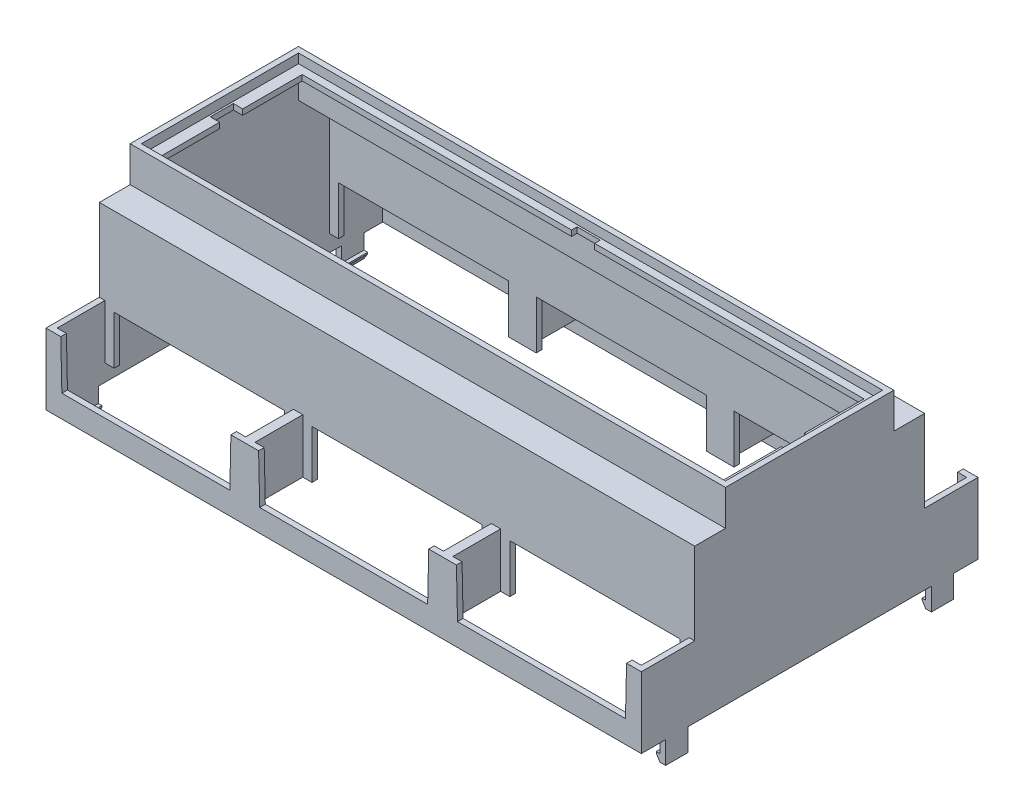
from build123d import *

# Parameters (mm, degrees)
SKETCH_1_W                 = 159.5
SKETCH_1_H                 = 90.2
EXTRUDE_1_DEPTH            = 50.5
CUT_EXTRUDE_1_DEPTH        = 174.275820587
SHELL_1_T                  = -1.5
SKETCH_3_W                 = 6
SKETCH_3_H                 = 6
EXTRUDE_3_DEPTH            = 1.5
EXTRUDE_4_DEPTH            = 6
MIRROR_2_COPY_1_SKETCH_W   = 6
MIRROR_2_COPY_1_SKETCH_H   = 6
MIRROR_2_COPY_1_DEPTH      = 1.5
MIRROR_2_COPY_2_DEPTH      = 6
SKETCH_6_W                 = 50.5
SKETCH_6_H                 = 12.8
CUT_EXTRUDE_2_DEPTH        = 20
CUT_EXTRUDE_3_DEPTH        = 10
PATTERN_LINEAR_1_COUNT     = 2
PATTERN_LINEAR_1_PITCH     = 53
PATTERN_LINEAR_1_COL_COUNT = 2
PATTERN_LINEAR_1_COL_PITCH = 53
SKETCH_8_W                 = 2.45
SKETCH_8_H                 = 1.5
EXTRUDE_5_DEPTH            = 16
SKETCH_9_W                 = 156.5
SKETCH_9_H                 = 22.55
CUT_EXTRUDE_4_DEPTH        = 4.5
MIRROR_3_COPY_1_DEPTH      = 10
MIRROR_3_COPY_2_DEPTH      = 10
SKETCH_10_W                = 159.5
SKETCH_10_H                = 45.1
EXTRUDE_6_DEPTH            = 4
SKETCH_11_W                = 156.5
SKETCH_11_H                = 42.1
CUT_EXTRUDE_6_DEPTH        = 2.5
SKETCH_12_W                = 150.5
SKETCH_12_H                = 38.1
CUT_EXTRUDE_7_DEPTH        = 4
SKETCH_13_W                = 4
SKETCH_13_H                = 6.2
SKETCH_13_W_2              = 6.2
SKETCH_13_H_2              = 4
CUT_EXTRUDE_8_DEPTH        = 4


with BuildPart() as part:
    # Эскиз1 → Бобышка-Вытянуть1 (new body)
    with BuildSketch(Plane(origin=(0, 0, 0), x_dir=(1, 0, 0), z_dir=(0, 1, 0))):
        Rectangle(SKETCH_1_W, SKETCH_1_H)
    extrude(amount=EXTRUDE_1_DEPTH)

    # Эскиз2 → Вырез-Вытянуть1 (cut, through all)
    with BuildSketch(Plane(origin=(79.75, 0, 0), x_dir=(0, 0, -1), z_dir=(1, 0, 0))):
        Polygon((-46.1, 19), (-30.8, 19), (-30.8, 41), (-22.55, 41), (-22.55, 51.5), (22.55, 51.5), (22.55, 41), (30.8, 41), (30.8, 19), (46.1, 19), (46.1, 52.5), (-46.1, 52.5), align=None)
    extrude(amount=-CUT_EXTRUDE_1_DEPTH, mode=Mode.SUBTRACT)

    # Оболочка1
    shell_1_openings = [part.faces().sort_by_distance(p)[0] for p in [
        (0, 0, 0),
    ]]
    offset(amount=SHELL_1_T, openings=shell_1_openings, kind=Kind.INTERSECTION)

    # Эскиз3 → Бобышка-Вытянуть3 (add)
    with BuildSketch(Plane(origin=(79.75, 0, 0), x_dir=(0, 0, -1), z_dir=(1, 0, 0))):
        with Locations((-35.6, -3)):
            Rectangle(SKETCH_3_W, SKETCH_3_H)
    extrude_3 = extrude(amount=-EXTRUDE_3_DEPTH)

    # Эскиз4 → Бобышка-Вытянуть4 (add)
    with BuildSketch(Plane.XY.offset(38.6)):
        Polygon((78.25, -6), (77.25, -4.4), (77.25, -4), (78.75, -4), (78.75, -6), align=None)
    extrude_4 = extrude(amount=-EXTRUDE_4_DEPTH)

    # Зеркальное отражение1: Бобышка-Вытянуть3, Бобышка-Вытянуть4 across plane
    add(extrude_3.mirror(Plane.XY))
    add(extrude_4.mirror(Plane.XY))

    # Зеркальное отражение2: Бобышка-Вытянуть3, Бобышка-Вытянуть4 across plane
    add(extrude_3.mirror(Plane(origin=(0, 0, 0), x_dir=(0, 0, 1), z_dir=(1, 0, 0))))
    add(extrude_4.mirror(Plane(origin=(0, 0, 0), x_dir=(0, 0, 1), z_dir=(1, 0, 0))))

    # Зеркальное отражение2 copy 1 sketch → Зеркальное отражение2 copy 1 (add)
    with BuildSketch(Plane.ZY.offset(79.75)):
        with Locations((-35.6, -3)):
            Rectangle(MIRROR_2_COPY_1_SKETCH_W, MIRROR_2_COPY_1_SKETCH_H)
    extrude(amount=-MIRROR_2_COPY_1_DEPTH)

    # Зеркальное отражение2 copy 2 sketch → Зеркальное отражение2 copy 2 (add)
    with BuildSketch(Plane(origin=(0, 0, -38.6), x_dir=(-1, 0, 0), z_dir=(0, 0, -1))):
        Polygon((78.25, -6), (77.25, -4.4), (77.25, -4), (78.75, -4), (78.75, -6), align=None)
    extrude(amount=-MIRROR_2_COPY_2_DEPTH)

    # Эскиз6 → Вырез-Вытянуть2 (cut)
    with BuildSketch(Plane(origin=(0, 19, 0), x_dir=(1, 0, 0), z_dir=(0, 1, 0))):
        with Locations((0, -37.2)):
            Rectangle(SKETCH_6_W, SKETCH_6_H)
        with Locations((-53, -37.2)):
            Rectangle(SKETCH_6_W, SKETCH_6_H)
        with Locations((53, -37.2)):
            Rectangle(SKETCH_6_W, SKETCH_6_H)
    cut_extrude_2 = extrude(amount=-CUT_EXTRUDE_2_DEPTH, mode=Mode.SUBTRACT)

    # Эскиз7 → Вырез-Вытянуть3 (cut)
    with BuildSketch(Plane.XY.offset(45.1)):
        Polygon((-22.8, 19.5), (-22.5, 6), (22.5, 6), (22.8, 19.5), align=None)
    cut_extrude_3 = extrude(amount=-CUT_EXTRUDE_3_DEPTH, mode=Mode.SUBTRACT)

    # Линейный массив1: Вырез-Вытянуть3 ×2
    with Locations(*[(i * PATTERN_LINEAR_1_PITCH, 0, 0) for i in range(1, PATTERN_LINEAR_1_COUNT)]):
        add(cut_extrude_3, mode=Mode.SUBTRACT)

    # Линейный массив1 col: Вырез-Вытянуть3 ×2
    with Locations(*[(-i * PATTERN_LINEAR_1_COL_PITCH, 0, 0) for i in range(1, PATTERN_LINEAR_1_COL_COUNT)]):
        add(cut_extrude_3, mode=Mode.SUBTRACT)

    # Эскиз8 → Бобышка-Вытянуть5 (add)
    with BuildSketch(Plane.XZ.offset(-17.5)):
        Polygon((-30.2, 30.8), (-30.2, 29.3), (-22.8, 29.3), (-22.8, 30.8), (-25.25, 30.8), (-25.25, 43.6), (-27.75, 43.6), (-27.75, 30.8), align=None)
        Polygon((22.8, 30.8), (22.8, 29.3), (30.2, 29.3), (30.2, 30.8), (27.75, 30.8), (27.75, 43.6), (25.25, 43.6), (25.25, 30.8), align=None)
        with Locations((-77.025, 30.05)):
            Rectangle(SKETCH_8_W, SKETCH_8_H)
        with Locations((77.025, 30.05)):
            Rectangle(SKETCH_8_W, SKETCH_8_H)
    extrude_5 = extrude(amount=EXTRUDE_5_DEPTH)

    # Эскиз9 → Вырез-Вытянуть4 (cut)
    with BuildSketch(Plane.XZ):
        with Locations((0, 32.325)):
            Rectangle(SKETCH_9_W, SKETCH_9_H)
    cut_extrude_4 = extrude(amount=-CUT_EXTRUDE_4_DEPTH, mode=Mode.SUBTRACT)

    # Зеркальное отражение3: Вырез-Вытянуть2, Вырез-Вытянуть3, Бобышка-Вытянуть5, Вырез-Вытянуть4 across plane
    add(cut_extrude_2.mirror(Plane.XY), mode=Mode.SUBTRACT)
    add(cut_extrude_3.mirror(Plane.XY), mode=Mode.SUBTRACT)
    add(extrude_5.mirror(Plane.XY))
    add(cut_extrude_4.mirror(Plane.XY), mode=Mode.SUBTRACT)

    # Зеркальное отражение3 copy 1 sketch → Зеркальное отражение3 copy 1 (cut)
    with BuildSketch(Plane(origin=(53, 0, -45.1), x_dir=(1, 0, 0), z_dir=(0, 0, -1))):
        Polygon((-22.8, -19.5), (-22.5, -6), (22.5, -6), (22.8, -19.5), align=None)
    extrude(amount=-MIRROR_3_COPY_1_DEPTH, mode=Mode.SUBTRACT)

    # Зеркальное отражение3 copy 2 sketch → Зеркальное отражение3 copy 2 (cut)
    with BuildSketch(Plane(origin=(-53, 0, -45.1), x_dir=(1, 0, 0), z_dir=(0, 0, -1))):
        Polygon((-22.8, -19.5), (-22.5, -6), (22.5, -6), (22.8, -19.5), align=None)
    extrude(amount=-MIRROR_3_COPY_2_DEPTH, mode=Mode.SUBTRACT)

    # Эскиз10 → Бобышка-Вытянуть6 (add)
    with BuildSketch(Plane(origin=(0, 50.5, 0), x_dir=(1, 0, 0), z_dir=(0, 1, 0))):
        Rectangle(SKETCH_10_W, SKETCH_10_H)
    extrude(amount=-EXTRUDE_6_DEPTH)

    # Эскиз11 → Вырез-Вытянуть6 (cut)
    with BuildSketch(Plane(origin=(0, 50.5, 0), x_dir=(1, 0, 0), z_dir=(0, 1, 0))):
        Rectangle(SKETCH_11_W, SKETCH_11_H)
    extrude(amount=-CUT_EXTRUDE_6_DEPTH, mode=Mode.SUBTRACT)

    # Эскиз12 → Вырез-Вытянуть7 (cut)
    with BuildSketch(Plane(origin=(0, 48, 0), x_dir=(1, 0, 0), z_dir=(0, 1, 0))):
        Rectangle(SKETCH_12_W, SKETCH_12_H)
    extrude(amount=-CUT_EXTRUDE_7_DEPTH, mode=Mode.SUBTRACT)

    # Эскиз13 → Вырез-Вытянуть8 (cut)
    with BuildSketch(Plane(origin=(0, 48, 0), x_dir=(1, 0, 0), z_dir=(0, 1, 0))):
        with Locations((-75.75, 0)):
            Rectangle(SKETCH_13_W, SKETCH_13_H)
        with Locations((0, 18.55)):
            Rectangle(SKETCH_13_W_2, SKETCH_13_H_2)
        with Locations((0, -18.55)):
            Rectangle(SKETCH_13_W_2, SKETCH_13_H_2)
        with Locations((75.75, 0)):
            Rectangle(SKETCH_13_W, SKETCH_13_H)
    extrude(amount=-CUT_EXTRUDE_8_DEPTH, mode=Mode.SUBTRACT)


solid = part.part
